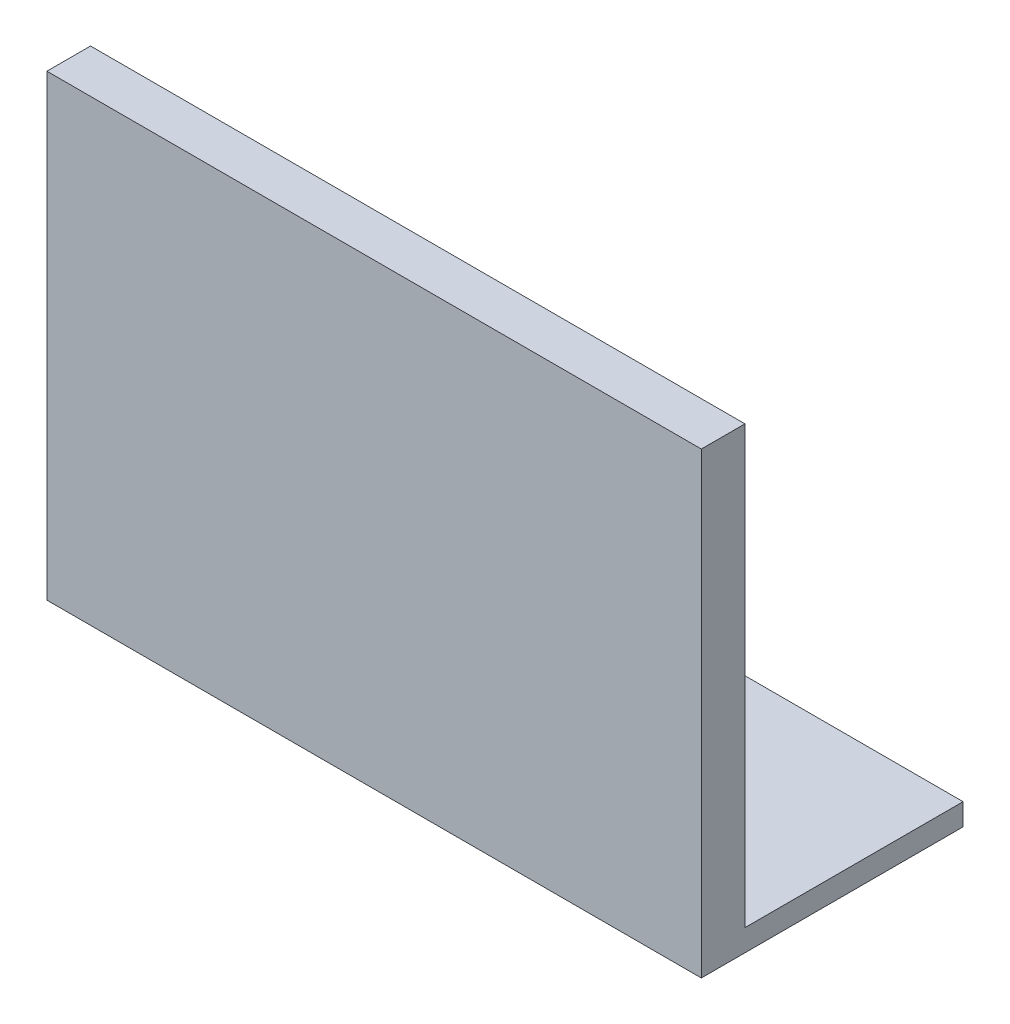
from build123d import *

# Parameters (mm, degrees)
SKETCH2_W           = 150
SKETCH2_H           = 60
BOSS_EXTRUDE2_DEPTH = 5
SKETCH3_W           = 150
SKETCH3_H           = 10
BOSS_EXTRUDE3_DEPTH = 100
SKETCH4_R           = 3.5
CUT_EXTRUDE1_DEPTH  = 129.549601322
SKETCH6_R           = 5
CUT_EXTRUDE2_DEPTH  = 1


with BuildPart() as part:
    # Sketch2 → Boss-Extrude2 (new body)
    with BuildSketch(Plane(origin=(0, 0, 0), x_dir=(1, 0, 0), z_dir=(0, 1, 0))):
        Rectangle(SKETCH2_W, SKETCH2_H)
    extrude(amount=BOSS_EXTRUDE2_DEPTH)

    # Sketch3 → Boss-Extrude3 (add)
    with BuildSketch(Plane(origin=(0, 5, 0), x_dir=(1, 0, 0), z_dir=(0, 1, 0))):
        with Locations((0, -25)):
            Rectangle(SKETCH3_W, SKETCH3_H)
    extrude(amount=BOSS_EXTRUDE3_DEPTH)

    # Sketch4 → Cut-Extrude1 (cut, through all)
    with BuildSketch(Plane(origin=(0, 5, 0), x_dir=(1, 0, 0), z_dir=(0, 1, 0))):
        with Locations(Location((-25, 15, 0), (0, 0, 270))):
            Circle(SKETCH4_R)
        with Locations(Location((25, 15, 0), (0, 0, 270))):
            Circle(SKETCH4_R)
    extrude(amount=-CUT_EXTRUDE1_DEPTH, mode=Mode.SUBTRACT)

    # Sketch6 → Cut-Extrude2 (cut)
    with BuildSketch(Plane(origin=(0, 5, 0), x_dir=(1, 0, 0), z_dir=(0, 1, 0))):
        with Locations(Location((-25, 15, 0), (0, 0, 270))):
            Circle(SKETCH6_R)
        with Locations(Location((25, 15, 0), (0, 0, 270))):
            Circle(SKETCH6_R)
    extrude(amount=-CUT_EXTRUDE2_DEPTH, mode=Mode.SUBTRACT)


solid = part.part
